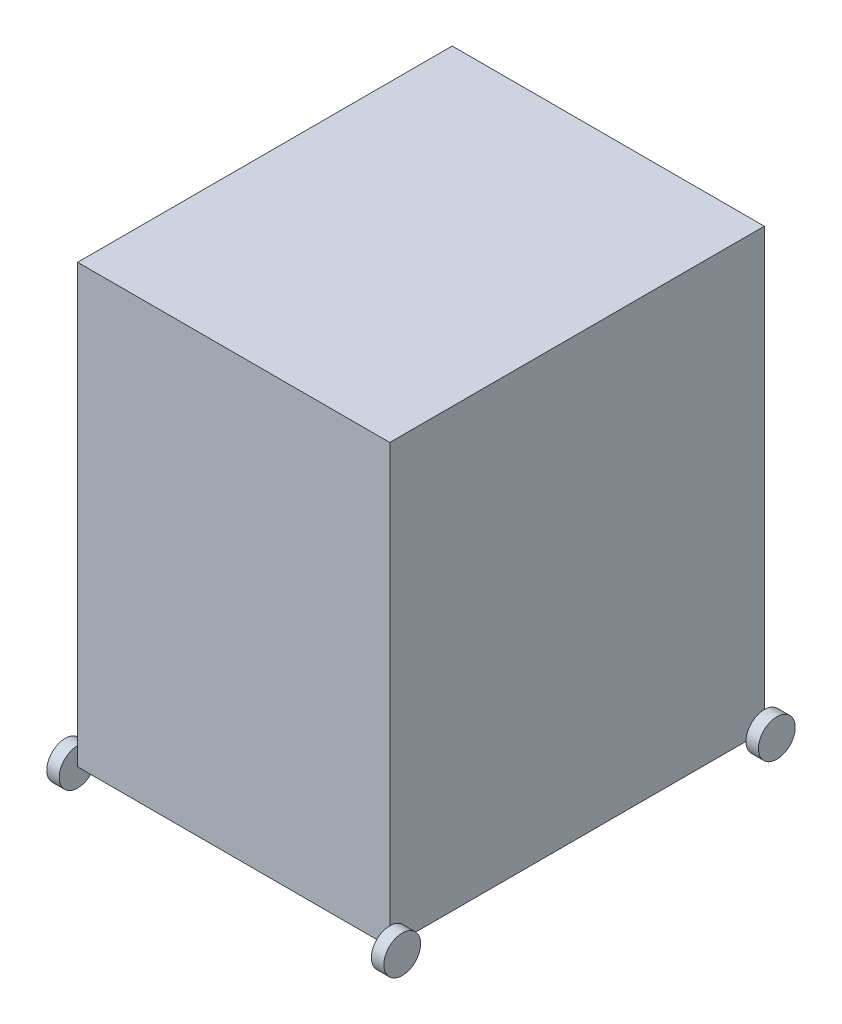
from build123d import *

# Parameters (mm, degrees)
SKETCH1_W           = 250
SKETCH1_H           = 300
BOSS_EXTRUDE1_DEPTH = 350
SKETCH2_R           = 14.75
BOSS_EXTRUDE2_DEPTH = 10
LPATTERN2_COUNT     = 2
LPATTERN2_PITCH     = 260


with BuildPart() as part:
    # Sketch1 → Boss-Extrude1 (new body)
    with BuildSketch(Plane(origin=(0, 0, 0), x_dir=(1, 0, 0), z_dir=(0, 1, 0))):
        with Locations((-29.444356891, 74.84242821)):
            Rectangle(SKETCH1_W, SKETCH1_H)
    extrude(amount=BOSS_EXTRUDE1_DEPTH)

    # Sketch2 → Boss-Extrude2 (add)
    with BuildSketch(Plane(origin=(95.555643109, 0, 0), x_dir=(0, 0, -1), z_dir=(1, 0, 0))):
        with Locations((-75.15757179, 0)):
            Circle(SKETCH2_R)
        with Locations(Location((224.84242821, 0, 0), (0, 0, 180))):
            Circle(SKETCH2_R)
    boss_extrude2 = extrude(amount=BOSS_EXTRUDE2_DEPTH)

    # LPattern2: Boss-Extrude2 ×2
    with Locations(*[(-i * LPATTERN2_PITCH, 0, 0) for i in range(1, LPATTERN2_COUNT)]):
        add(boss_extrude2)


solid = part.part
